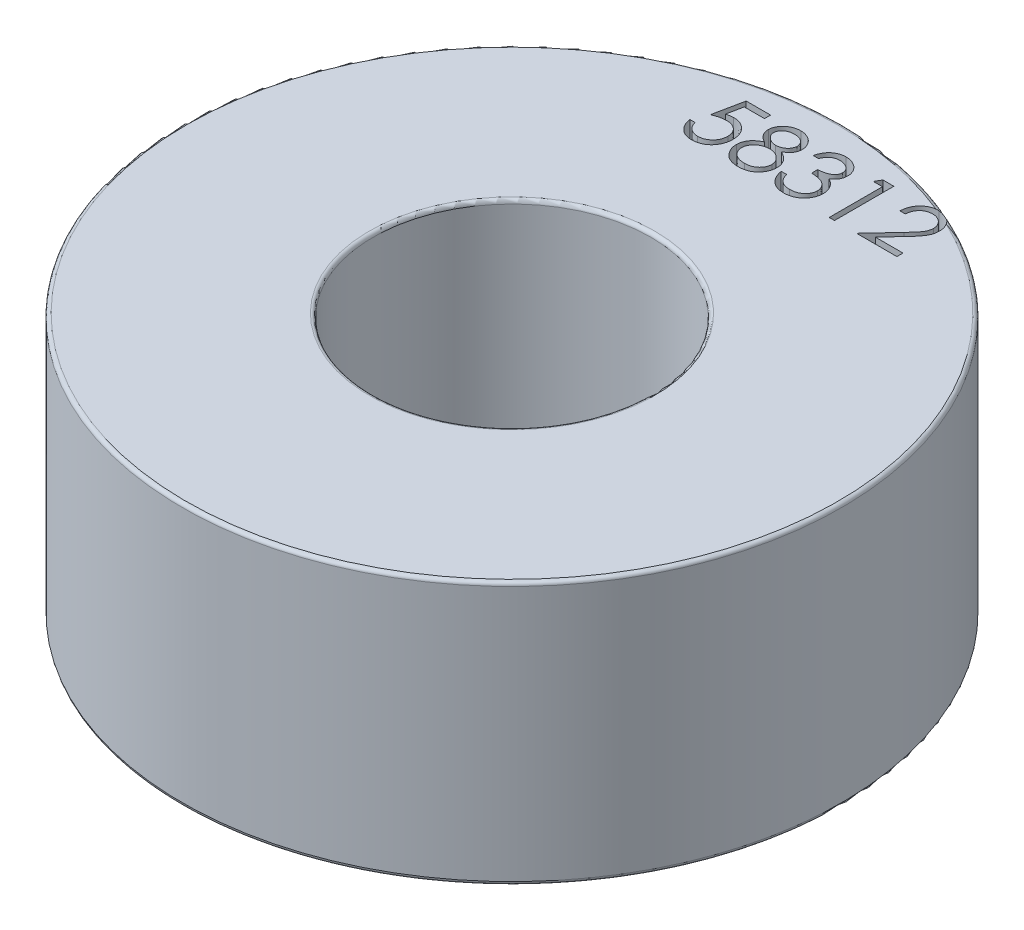
from build123d import *

# Parameters (mm, degrees)
CUT_EXTRUDE1_DEPTH = 1


with BuildPart() as part:
    # Toroidal Core TC229 → Revolve2 (revolve)
    with BuildSketch(Plane.XY, mode=Mode.PRIVATE) as revolve2_sk:
        with BuildLine():
            Line((5.719098459, 0), (13.073018459, 0))
            ThreePointArc((13.073018459, 0), (13.176297385, 0.042779532), (13.219076917, 0.146058459))
            Line((13.219076917, 0.146058459), (13.219076917, 10.397861541))
            ThreePointArc((13.219076917, 10.397861541), (13.176297385, 10.501140468), (13.073018459, 10.54392))
            Line((13.073018459, 10.54392), (5.719098459, 10.54392))
            ThreePointArc((5.719098459, 10.54392), (5.615819532, 10.501140468), (5.57304, 10.397861541))
            Line((5.57304, 10.397861541), (5.57304, 0.146058459))
            ThreePointArc((5.57304, 0.146058459), (5.615819532, 0.042779532), (5.719098459, 0))
        make_face()
    revolve(revolve2_sk.sketch.rotate(Axis((0, -8.107972275, 0), (0, 1, 0)), 90), axis=Axis((0, -8.107972275, 0), (0, 1, 0)))

    # Sketch1 → Cut-Extrude1 (cut)
    # profile 1 of 5: a face of its own
    with BuildSketch(Plane(origin=(0, 10.54392, 0), x_dir=(1, 0, 0), z_dir=(0, 1, 0))):
        with BuildLine():
            Line((-1.697112471, 12.070301335), (-1.697112471, 11.826070566))
            Line((-1.697112471, 11.826070566), (-2.507080921, 11.826070566))
            Line((-2.507080921, 11.826070566), (-2.635397477, 11.199752206))
            add(Edge.make_bspline(
                [(-2.635397477, 11.199752206), (-2.610186248, 11.206712445), (-2.56134348, 11.220196806), (-2.489252932, 11.235168589), (-2.420814308, 11.244193829), (-2.376403743, 11.245426167), (-2.354913703, 11.246022489)],
                knots=[0, 0, 0, 0, 1.100273476, 2.13160584, 3.095893838, 4, 4, 4, 4], degree=3))
            add(Edge.make_bspline(
                [(-2.354913703, 11.246022489), (-2.328322802, 11.24544695), (-2.276038446, 11.244315298), (-2.199539805, 11.233448736), (-2.126515104, 11.216344616), (-2.057117063, 11.192450118), (-1.991217296, 11.16189546), (-1.929422116, 11.123727465), (-1.870803964, 11.079141395), (-1.816414449, 11.027879878), (-1.767072018, 10.971463564), (-1.723688372, 10.910804369), (-1.686838466, 10.846491799), (-1.657201596, 10.777911385), (-1.633535825, 10.705821318), (-1.6177842, 10.629463079), (-1.607295332, 10.549556412), (-1.606123494, 10.494920624), (-1.605525933, 10.467059899)],
                knots=[0, 0, 0, 0, 1.052922333, 2.070308379, 3.05430497, 4.020497103, 4.973039431, 5.925935799, 6.892292201, 7.88610001, 8.88166317, 9.857072816, 10.836096531, 11.812156883, 12.81219415, 13.836441305, 14.89672472, 16, 16, 16, 16], degree=3))
            add(Edge.make_bspline(
                [(-1.605525933, 10.467059899), (-1.605978421, 10.447654602), (-1.606877284, 10.409106255), (-1.611448323, 10.351858147), (-1.62024923, 10.295822006), (-1.632065485, 10.240990396), (-1.64740238, 10.187467127), (-1.665968683, 10.135098998), (-1.688689909, 10.084211953), (-1.713612326, 10.034324497), (-1.741674662, 9.986564441), (-1.772820397, 9.941899684), (-1.805726204, 9.8996602), (-1.841132933, 9.860298999), (-1.879369681, 9.824074732), (-1.919973373, 9.790772419), (-1.962620008, 9.759828871), (-2.007969379, 9.732500152), (-2.055010961, 9.707352141), (-2.104424087, 9.686721306), (-2.155083957, 9.668276464), (-2.207719702, 9.653574268), (-2.2622121, 9.642054084), (-2.318650974, 9.634229568), (-2.376740323, 9.628530599), (-2.416116001, 9.628173849), (-2.436005951, 9.627993643)],
                knots=[0, 0, 0, 0, 1.056347294, 2.098418968, 3.122841568, 4.141288669, 5.149314143, 6.15115421, 7.162517403, 8.180376062, 9.185164535, 10.17417709, 11.141909838, 12.097768115, 13.052685741, 14.0056014, 14.954263652, 15.917497458, 16.885230207, 17.854509472, 18.828990115, 19.81800267, 20.826176721, 21.857883937, 22.917946725, 24, 24, 24, 24], degree=3))
            add(Edge.make_bspline(
                [(-2.436005951, 9.627993643), (-2.459732849, 9.628463659), (-2.506412717, 9.629388361), (-2.574802603, 9.639062009), (-2.640603076, 9.652916745), (-2.703284448, 9.67376035), (-2.763408469, 9.69987742), (-2.820165711, 9.732885744), (-2.875006426, 9.77029117), (-2.925701223, 9.814432982), (-2.972752079, 9.862680972), (-3.014870614, 9.915039653), (-3.052381137, 9.970644863), (-3.084682961, 10.029766643), (-3.112236079, 10.092249643), (-3.133881634, 10.158327971), (-3.151352086, 10.227656366), (-3.158743092, 10.275385808), (-3.162497087, 10.299628258)],
                knots=[0, 0, 0, 0, 1.0467383, 2.05933395, 3.04377827, 4.011590433, 4.970194871, 5.932262533, 6.905835911, 7.896367577, 8.894135286, 9.877477877, 10.858688626, 11.851381753, 12.8477658, 13.868841284, 14.917554742, 16, 16, 16, 16], degree=3))
            Line((-3.162497087, 10.299628258), (-2.948795164, 10.299628258))
            add(Edge.make_bspline(
                [(-2.948795164, 10.299628258), (-2.943536984, 10.27692035), (-2.933430472, 10.23327449), (-2.911246918, 10.171952989), (-2.884123885, 10.117307231), (-2.851871998, 10.068614354), (-2.81339778, 10.026153947), (-2.769494723, 9.988314481), (-2.720272432, 9.954177474), (-2.665576324, 9.925723055), (-2.60787314, 9.901455564), (-2.547479735, 9.885295929), (-2.486040527, 9.873933357), (-2.444485422, 9.872795963), (-2.423603607, 9.872224412)],
                knots=[0, 0, 0, 0, 1.136247022, 2.183929868, 3.172523383, 4.106158343, 5.02341133, 5.958108904, 6.928429099, 7.938127109, 8.96079061, 9.975095812, 10.982467395, 12, 12, 12, 12], degree=3))
            add(Edge.make_bspline(
                [(-2.423603607, 9.872224412), (-2.403221165, 9.872782834), (-2.363087971, 9.873882372), (-2.304025224, 9.882345342), (-2.247002536, 9.895379333), (-2.192582567, 9.914885073), (-2.139813019, 9.938591927), (-2.090028722, 9.969014148), (-2.041789443, 10.004025339), (-1.996594588, 10.044136903), (-1.955202034, 10.088339499), (-1.918628673, 10.13560894), (-1.88816438, 10.186034866), (-1.86249171, 10.238744279), (-1.842997233, 10.294314869), (-1.829090066, 10.352486204), (-1.820923699, 10.413401967), (-1.819800307, 10.454950908), (-1.819227856, 10.47612315)],
                knots=[0, 0, 0, 0, 1.027316725, 2.022795036, 3.002884548, 3.971462791, 4.93288096, 5.914575861, 6.907176829, 7.935150275, 8.956128384, 9.956726525, 10.942570165, 11.921478529, 12.907843606, 13.90538589, 14.932640048, 16, 16, 16, 16], degree=3))
            add(Edge.make_bspline(
                [(-1.819227856, 10.47612315), (-1.819675857, 10.495224688), (-1.820552756, 10.532613231), (-1.827717304, 10.587313405), (-1.840179387, 10.639070243), (-1.857476706, 10.688133677), (-1.879438299, 10.734549984), (-1.90627588, 10.778367066), (-1.938493102, 10.819007406), (-1.975294905, 10.856490018), (-2.015611536, 10.891082692), (-2.060136654, 10.920572151), (-2.107938497, 10.945380638), (-2.158441135, 10.966790115), (-2.212845825, 10.982166694), (-2.270075177, 10.993710916), (-2.330747187, 11.000388868), (-2.37222903, 11.001315438), (-2.393551774, 11.001791719)],
                knots=[0, 0, 0, 0, 1.045622112, 2.046656509, 3.013763289, 3.955457236, 4.890082067, 5.820317437, 6.762574623, 7.722996705, 8.69280354, 9.665887285, 10.63943826, 11.638615906, 12.663482002, 13.728887084, 14.832589034, 16, 16, 16, 16], degree=3))
            add(Edge.make_bspline(
                [(-2.393551774, 11.001791719), (-2.412009135, 11.00139671), (-2.450118901, 11.000581116), (-2.50857711, 10.994575946), (-2.570007729, 10.98488814), (-2.63417527, 10.971562497), (-2.701272437, 10.954124211), (-2.771157634, 10.933227381), (-2.843977801, 10.908243307), (-2.89304361, 10.889375497), (-2.918266317, 10.879676335)],
                knots=[0, 0, 0, 0, 0.817624296, 1.688186739, 2.600797293, 3.572016777, 4.590301741, 5.671205678, 6.80286297, 8, 8, 8, 8], degree=3))
            Line((-2.918266317, 10.879676335), (-2.674035548, 12.070301335))
            Line((-2.674035548, 12.070301335), (-1.697112471, 12.070301335))
        make_face()
    # profile 2 of 5: a face of its own
    with BuildSketch(Plane(origin=(0, 10.54392, 0), x_dir=(1, 0, 0), z_dir=(0, 1, 0))):
        with BuildLine():
            add(Edge.make_bspline(
                [(-0.203584076, 11.015625103), (-0.184092832, 11.005461958), (-0.146078397, 10.985640431), (-0.091937475, 10.953724314), (-0.042458501, 10.920086801), (0.003731327, 10.886316689), (0.0458205, 10.851120691), (0.083338395, 10.814358847), (0.117211758, 10.776948766), (0.146757481, 10.738256964), (0.172744971, 10.698386233), (0.195205013, 10.657231924), (0.214402789, 10.614884228), (0.229617574, 10.570880884), (0.242150971, 10.525868278), (0.25077491, 10.479265187), (0.255412849, 10.431378697), (0.256289702, 10.399015264), (0.256733683, 10.382628558)],
                knots=[0, 0, 0, 0, 1.272397273, 2.481599622, 3.635517121, 4.734568067, 5.792894095, 6.808321871, 7.773003508, 8.711915296, 9.623354172, 10.525449501, 11.423591555, 12.311487226, 13.218079475, 14.126165749, 15.051214107, 16, 16, 16, 16], degree=3))
            add(Edge.make_bspline(
                [(0.256733683, 10.382628558), (0.256208841, 10.359702065), (0.255169983, 10.314321933), (0.246121244, 10.247343418), (0.232573307, 10.182293259), (0.212788853, 10.119185718), (0.187130278, 10.058369019), (0.155509431, 9.999791104), (0.119715021, 9.942491895), (0.090968409, 9.907236195), (0.076422685, 9.889396888)],
                knots=[0, 0, 0, 0, 1.025265484, 2.029385089, 3.018602448, 3.995076438, 4.983346944, 5.966715145, 6.97116228, 8, 8, 8, 8], degree=3))
            add(Edge.make_bspline(
                [(0.076422685, 9.889396888), (0.057483941, 9.868582195), (0.019840484, 9.827210022), (-0.044645758, 9.773495275), (-0.11541779, 9.728353991), (-0.192201762, 9.691565791), (-0.274792426, 9.662932376), (-0.363172183, 9.642356663), (-0.457513329, 9.630571225), (-0.522355088, 9.628867617), (-0.555619833, 9.627993643)],
                knots=[0, 0, 0, 0, 0.954267603, 1.896743057, 2.838368354, 3.796610408, 4.779680527, 5.799409237, 6.871065594, 8, 8, 8, 8], degree=3))
            add(Edge.make_bspline(
                [(-0.555619833, 9.627993643), (-0.587605728, 9.628777739), (-0.64984703, 9.630303512), (-0.740441943, 9.640641152), (-0.82488996, 9.658757611), (-0.903682099, 9.683552961), (-0.976343353, 9.715808849), (-1.042666678, 9.755955641), (-1.103608969, 9.80237739), (-1.157320767, 9.856407325), (-1.20500594, 9.914277056), (-1.246894205, 9.973979491), (-1.281710855, 10.035520079), (-1.311188753, 10.097981196), (-1.333754854, 10.162238312), (-1.349384162, 10.227960821), (-1.359310106, 10.295033927), (-1.360630771, 10.340299213), (-1.361295164, 10.363071016)],
                knots=[0, 0, 0, 0, 1.256902934, 2.445805442, 3.576955095, 4.645999104, 5.686449165, 6.692658513, 7.68621702, 8.689161843, 9.678783111, 10.630372946, 11.551080876, 12.453998257, 13.34127905, 14.221779781, 15.105423033, 16, 16, 16, 16], degree=3))
            add(Edge.make_bspline(
                [(-1.361295164, 10.363071016), (-1.360901998, 10.379780038), (-1.360124964, 10.412802963), (-1.354746844, 10.461590916), (-1.346100552, 10.509077215), (-1.334357957, 10.555437257), (-1.318443705, 10.60033353), (-1.299228968, 10.643978763), (-1.276823479, 10.68642223), (-1.250914686, 10.72789604), (-1.220773488, 10.767819066), (-1.186644291, 10.80686884), (-1.147844973, 10.844439432), (-1.104807173, 10.880989868), (-1.058022727, 10.917168521), (-1.006276443, 10.951020187), (-0.950940093, 10.984941409), (-0.911611772, 11.005221716), (-0.891437141, 11.015625103)],
                knots=[0, 0, 0, 0, 0.941657376, 1.861047343, 2.762797495, 3.66048619, 4.553285746, 5.444104102, 6.34607688, 7.256116206, 8.197091036, 9.162375105, 10.176350973, 11.237807142, 12.343728897, 13.50695164, 14.721116704, 16, 16, 16, 16], degree=3))
            add(Edge.make_bspline(
                [(-0.891437141, 11.015625103), (-0.919053772, 11.030684651), (-0.972527301, 11.059844151), (-1.043331689, 11.113420103), (-1.104149238, 11.171446277), (-1.153308251, 11.235147977), (-1.192001678, 11.302535225), (-1.218548264, 11.373186404), (-1.236507301, 11.445791474), (-1.238286317, 11.495393725), (-1.239179779, 11.520305091)],
                knots=[0, 0, 0, 0, 1.166880483, 2.259407225, 3.286803203, 4.280235371, 5.237608625, 6.161067461, 7.076446754, 8, 8, 8, 8], degree=3))
            add(Edge.make_bspline(
                [(-1.239179779, 11.520305091), (-1.238067106, 11.545680751), (-1.235830441, 11.596690254), (-1.217744289, 11.672622277), (-1.188271172, 11.74720069), (-1.148183851, 11.820064023), (-1.098254334, 11.888746223), (-1.038351238, 11.950346402), (-0.969905066, 12.004306536), (-0.893257482, 12.04960211), (-0.810773543, 12.08646635), (-0.723745166, 12.111897027), (-0.633688677, 12.128522313), (-0.57239005, 12.130404627), (-0.541309436, 12.131359027)],
                knots=[0, 0, 0, 0, 0.888701115, 1.786444228, 2.72001202, 3.692817113, 4.693886446, 5.687152267, 6.695133018, 7.739871481, 8.800368666, 9.853104506, 10.91144658, 12, 12, 12, 12], degree=3))
            add(Edge.make_bspline(
                [(-0.541309436, 12.131359027), (-0.511030948, 12.130374997), (-0.451325218, 12.128434603), (-0.363562802, 12.11225103), (-0.279589805, 12.085220768), (-0.199695807, 12.048551407), (-0.12531109, 12.003384577), (-0.059587019, 11.948683268), (-0.001530387, 11.88735482), (0.04649221, 11.818693448), (0.086063747, 11.746110094), (0.113618825, 11.670166915), (0.131275435, 11.592504787), (0.133502492, 11.53995536), (0.134618298, 11.513626906)],
                knots=[0, 0, 0, 0, 1.072916533, 2.115669174, 3.151510826, 4.193348718, 5.225979165, 6.227137561, 7.216255879, 8.211077061, 9.189680878, 10.138522389, 11.067357538, 12, 12, 12, 12], degree=3))
            add(Edge.make_bspline(
                [(0.134618298, 11.513626906), (0.133642284, 11.487789211), (0.131725449, 11.437045448), (0.115601026, 11.363072583), (0.088445718, 11.293797231), (0.051370225, 11.228433312), (0.003047527, 11.168166258), (-0.055877343, 11.112229695), (-0.124934599, 11.060164121), (-0.176819237, 11.030781969), (-0.203584076, 11.015625103)],
                knots=[0, 0, 0, 0, 0.975232327, 1.915300861, 2.843280834, 3.77672583, 4.742871857, 5.749627742, 6.839139064, 8, 8, 8, 8], degree=3))
        make_face()
        with BuildLine():
            add(Edge.make_bspline(
                [(-0.553234767, 11.887128258), (-0.569938083, 11.886685046), (-0.602617073, 11.885817929), (-0.650533722, 11.881287678), (-0.696098851, 11.872474864), (-0.73978853, 11.860746383), (-0.781003757, 11.844902234), (-0.820304284, 11.826263844), (-0.857021247, 11.803603825), (-0.891597884, 11.778184867), (-0.92272475, 11.750227015), (-0.950350347, 11.721098395), (-0.97329751, 11.690226923), (-0.992783694, 11.658380521), (-1.006922548, 11.624614004), (-1.017511833, 11.589962614), (-1.024670137, 11.553988469), (-1.025206524, 11.529402736), (-1.025477856, 11.516965998)],
                knots=[0, 0, 0, 0, 1.203892937, 2.355340988, 3.463153438, 4.544400666, 5.610487187, 6.640501085, 7.674077295, 8.714426146, 9.728707835, 10.68524104, 11.601827946, 12.495867327, 13.368432065, 14.231010473, 15.105153427, 16, 16, 16, 16], degree=3))
            add(Edge.make_bspline(
                [(-1.025477856, 11.516965998), (-1.025010201, 11.504528723), (-1.024086047, 11.479950881), (-1.016938809, 11.44365664), (-1.006286556, 11.407991205), (-0.989515302, 11.373802638), (-0.969399619, 11.33990496), (-0.944572382, 11.307145365), (-0.914984312, 11.275409844), (-0.881628143, 11.244968324), (-0.845289221, 11.216462202), (-0.806791863, 11.191715448), (-0.766619229, 11.171009383), (-0.725184071, 11.153776342), (-0.682064092, 11.140380152), (-0.637523509, 11.130876484), (-0.591554837, 11.124969625), (-0.560407692, 11.124264081), (-0.544648529, 11.123907104)],
                knots=[0, 0, 0, 0, 0.873023192, 1.725219244, 2.590779336, 3.480155217, 4.391973325, 5.357036234, 6.360879153, 7.436073238, 8.526419356, 9.601555421, 10.645666583, 11.697338044, 12.750135903, 13.812665442, 14.89329948, 16, 16, 16, 16], degree=3))
            add(Edge.make_bspline(
                [(-0.544648529, 11.123907104), (-0.524407833, 11.124500966), (-0.484126358, 11.125682823), (-0.424745241, 11.136671389), (-0.367008335, 11.153956487), (-0.311532759, 11.177605678), (-0.259754461, 11.207288204), (-0.213598986, 11.242825311), (-0.173460029, 11.283396434), (-0.139754721, 11.328369971), (-0.113622307, 11.376234176), (-0.093278399, 11.42426759), (-0.081398536, 11.472982679), (-0.079848977, 11.505617346), (-0.079083625, 11.521736131)],
                knots=[0, 0, 0, 0, 1.076279235, 2.141928126, 3.20205304, 4.278698113, 5.344010996, 6.36967002, 7.368914609, 8.37248503, 9.349703398, 10.264243087, 11.142681841, 12, 12, 12, 12], degree=3))
            add(Edge.make_bspline(
                [(-0.079083625, 11.521736131), (-0.079445505, 11.533049134), (-0.080163786, 11.555503823), (-0.086082931, 11.588663318), (-0.095863632, 11.621068445), (-0.109105477, 11.652986905), (-0.126529284, 11.683970867), (-0.147187776, 11.714507396), (-0.17228241, 11.74390955), (-0.200446769, 11.772862521), (-0.232386413, 11.799657723), (-0.268039789, 11.823221696), (-0.307224109, 11.843232603), (-0.349940298, 11.859485488), (-0.396031041, 11.871692693), (-0.44528405, 11.880834208), (-0.498110004, 11.885986629), (-0.534461317, 11.886739461), (-0.553234767, 11.887128258)],
                knots=[0, 0, 0, 0, 0.814439003, 1.616544685, 2.417341072, 3.248991801, 4.09997495, 4.973547432, 5.9003056, 6.880240646, 7.880314356, 8.896779544, 9.951930927, 11.043077905, 12.18215768, 13.381699519, 14.647792085, 16, 16, 16, 16], degree=3))
        make_face(mode=Mode.SUBTRACT)
        with BuildLine():
            add(Edge.make_bspline(
                [(-0.539401383, 10.879676335), (-0.560578034, 10.879299661), (-0.602121455, 10.878560719), (-0.662984115, 10.870335541), (-0.72139493, 10.858885543), (-0.777156958, 10.841515455), (-0.830246652, 10.818929985), (-0.880951413, 10.791760236), (-0.928883342, 10.759643676), (-0.973380554, 10.722988335), (-1.014013748, 10.683487171), (-1.049663306, 10.641670968), (-1.079937512, 10.598316888), (-1.10431692, 10.552874318), (-1.124327402, 10.506305497), (-1.137467736, 10.457450687), (-1.145891722, 10.407249097), (-1.147022905, 10.373122316), (-1.14759324, 10.355915818)],
                knots=[0, 0, 0, 0, 1.140299081, 2.23698856, 3.303958914, 4.344563908, 5.37730929, 6.408454204, 7.439741482, 8.480804886, 9.510774543, 10.48932336, 11.43758569, 12.353841022, 13.263987381, 14.161954604, 15.073269652, 16, 16, 16, 16], degree=3))
            add(Edge.make_bspline(
                [(-1.14759324, 10.355915818), (-1.146665738, 10.334531577), (-1.144825594, 10.292105741), (-1.130227416, 10.229401937), (-1.106798954, 10.168699755), (-1.074124655, 10.110493873), (-1.033665467, 10.056099247), (-0.983913352, 10.008685991), (-0.927960211, 9.966557271), (-0.86391285, 9.932484622), (-0.793952768, 9.905273837), (-0.718098574, 9.886525941), (-0.637438888, 9.87411524), (-0.58174513, 9.87286462), (-0.553234767, 9.872224412)],
                knots=[0, 0, 0, 0, 0.898778495, 1.783155532, 2.693654817, 3.627872908, 4.583023416, 5.533784346, 6.509005473, 7.520592997, 8.575161974, 9.658835044, 10.801527049, 12, 12, 12, 12], degree=3))
            add(Edge.make_bspline(
                [(-0.553234767, 9.872224412), (-0.53095282, 9.872652226), (-0.487540443, 9.873485746), (-0.424208752, 9.880843328), (-0.364443086, 9.892511198), (-0.308359343, 9.909481717), (-0.255329695, 9.930198576), (-0.206253252, 9.956849582), (-0.159867504, 9.987161073), (-0.118458164, 10.023123497), (-0.080743784, 10.061549725), (-0.047859883, 10.102228308), (-0.019313764, 10.144053693), (0.003091047, 10.187971077), (0.021002302, 10.233137888), (0.033877078, 10.27997062), (0.041821074, 10.328612912), (0.042624505, 10.361609602), (0.04303176, 10.378335439)],
                knots=[0, 0, 0, 0, 1.224942928, 2.386581632, 3.501229538, 4.569074225, 5.605009692, 6.626002462, 7.634866581, 8.645888296, 9.63523824, 10.59253846, 11.518950513, 12.414518923, 13.29783783, 14.186679152, 15.080837789, 16, 16, 16, 16], degree=3))
            add(Edge.make_bspline(
                [(0.04303176, 10.378335439), (0.042415459, 10.394580559), (0.041200222, 10.426613096), (0.033487223, 10.474079251), (0.019937314, 10.519937237), (0.001344924, 10.564738759), (-0.023407124, 10.607576052), (-0.052556937, 10.64956509), (-0.0877274, 10.689540457), (-0.127468827, 10.727812652), (-0.170779655, 10.76320193), (-0.216817481, 10.794508182), (-0.265227927, 10.820873462), (-0.315908555, 10.842315934), (-0.368746829, 10.859180266), (-0.423703888, 10.870961327), (-0.480844073, 10.87837695), (-0.519661762, 10.879238313), (-0.539401383, 10.879676335)],
                knots=[0, 0, 0, 0, 0.917430815, 1.809013306, 2.70690318, 3.612392954, 4.541220862, 5.495268465, 6.494511384, 7.542276156, 8.608045339, 9.649016899, 10.681629292, 11.715607085, 12.752076957, 13.808767841, 14.885711793, 16, 16, 16, 16], degree=3))
        make_face(mode=Mode.SUBTRACT)
    # profile 3 of 5: a face of its own
    with BuildSketch(Plane(origin=(0, 10.54392, 0), x_dir=(1, 0, 0), z_dir=(0, 1, 0))):
        with BuildLine():
            Line((0.775724067, 11.520782104), (0.562022144, 11.520782104))
            add(Edge.make_bspline(
                [(0.562022144, 11.520782104), (0.567811678, 11.544752776), (0.579129742, 11.59161348), (0.602736484, 11.658565562), (0.628453478, 11.721922815), (0.659334279, 11.780498894), (0.693017914, 11.835471005), (0.731609622, 11.88559232), (0.773328934, 11.932137569), (0.819474122, 11.973444254), (0.867867015, 12.010848745), (0.919189498, 12.042740525), (0.972409002, 12.070175351), (1.027894259, 12.092776973), (1.085810458, 12.109803266), (1.145634005, 12.122156379), (1.207521672, 12.130178548), (1.249532086, 12.130961477), (1.270863791, 12.131359027)],
                knots=[0, 0, 0, 0, 1.162005537, 2.271625781, 3.343758855, 4.383309926, 5.390229558, 6.379919256, 7.361854164, 8.333198761, 9.295911338, 10.242430842, 11.177959212, 12.116337295, 13.062827104, 14.020064771, 14.994644689, 16, 16, 16, 16], degree=3))
            add(Edge.make_bspline(
                [(1.270863791, 12.131359027), (1.301944371, 12.130420658), (1.363427573, 12.128564388), (1.45375386, 12.111613673), (1.540857821, 12.084790503), (1.623786041, 12.047728914), (1.700815011, 12.002017545), (1.769351595, 11.947612965), (1.828466814, 11.885564869), (1.878061024, 11.81703075), (1.916892408, 11.743786555), (1.945526172, 11.668402876), (1.962958066, 11.591058535), (1.965217231, 11.538836172), (1.966349067, 11.512672879)],
                knots=[0, 0, 0, 0, 1.083050992, 2.142477498, 3.193116406, 4.255571735, 5.30263384, 6.308962982, 7.297363603, 8.282367274, 9.249857812, 10.179914175, 11.08814088, 12, 12, 12, 12], degree=3))
            add(Edge.make_bspline(
                [(1.966349067, 11.512672879), (1.96555741, 11.487495042), (1.964008259, 11.438225922), (1.950854434, 11.366297546), (1.928718155, 11.298505672), (1.898054621, 11.234564917), (1.85836153, 11.174880696), (1.810278856, 11.119318723), (1.753467224, 11.067632564), (1.710414946, 11.03802378), (1.688250359, 11.022780301)],
                knots=[0, 0, 0, 0, 1.024540389, 2.004866551, 2.965041327, 3.920577974, 4.882998113, 5.874504559, 6.905732034, 8, 8, 8, 8], degree=3))
            add(Edge.make_bspline(
                [(1.688250359, 11.022780301), (1.713581249, 11.010548724), (1.763769069, 10.986314431), (1.83217934, 10.938787568), (1.894280895, 10.883912446), (1.928913604, 10.841088962), (1.946314512, 10.819572669)],
                knots=[0, 0, 0, 0, 1.015518401, 2.012035669, 3.001164323, 4, 4, 4, 4], degree=3))
            add(Edge.make_bspline(
                [(1.946314512, 10.819572669), (1.95777264, 10.803885163), (1.98050126, 10.772767045), (2.00855615, 10.722736012), (2.034007708, 10.672150445), (2.053840268, 10.619654492), (2.069198559, 10.565856603), (2.080176824, 10.510664401), (2.08699682, 10.454032818), (2.087973508, 10.41572022), (2.088464452, 10.396461942)],
                knots=[0, 0, 0, 0, 1.025084078, 2.033381695, 3.024893161, 4.013698104, 4.991890475, 5.976764909, 6.982997093, 8, 8, 8, 8], degree=3))
            add(Edge.make_bspline(
                [(2.088464452, 10.396461942), (2.087243542, 10.363117828), (2.084807467, 10.296586518), (2.063033267, 10.198292109), (2.029278544, 10.10220833), (1.981342664, 10.010309198), (1.922922091, 9.924325403), (1.853418626, 9.847393129), (1.77362198, 9.781263364), (1.684627423, 9.726011405), (1.588209162, 9.681844033), (1.485083626, 9.65118888), (1.376736714, 9.63122312), (1.302436749, 9.629082125), (1.264662619, 9.627993643)],
                knots=[0, 0, 0, 0, 0.955779014, 1.907060117, 2.875433937, 3.871313158, 4.872415639, 5.851225146, 6.836215519, 7.83643374, 8.849228613, 9.86973379, 10.916971861, 12, 12, 12, 12], degree=3))
            add(Edge.make_bspline(
                [(1.264662619, 9.627993643), (1.239204131, 9.628584338), (1.189110315, 9.629746629), (1.115466078, 9.637692248), (1.045170422, 9.65220427), (0.978128303, 9.671732769), (0.914280162, 9.69649215), (0.853820833, 9.72732505), (0.796378352, 9.763595911), (0.74249478, 9.80573287), (0.69217654, 9.852868925), (0.646760847, 9.905840858), (0.605490524, 9.963669449), (0.569470621, 10.027026386), (0.53706048, 10.095092891), (0.510403437, 10.16874053), (0.486940934, 10.247310909), (0.476032452, 10.302064515), (0.470435606, 10.330157104)],
                knots=[0, 0, 0, 0, 1.048658725, 2.063410685, 3.046034179, 4.001477787, 4.936774919, 5.862367409, 6.792675028, 7.730719943, 8.675894397, 9.627829632, 10.600096036, 11.597688215, 12.626045268, 13.701542398, 14.82072376, 16, 16, 16, 16], degree=3))
            Line((0.470435606, 10.330157104), (0.684137529, 10.330157104))
            add(Edge.make_bspline(
                [(0.684137529, 10.330157104), (0.68970509, 10.31182215), (0.700534479, 10.276159073), (0.718968278, 10.224832722), (0.739969727, 10.177780547), (0.762499454, 10.134657387), (0.786161218, 10.095038556), (0.812637265, 10.059971677), (0.83996663, 10.027916513), (0.860567405, 10.009856696), (0.870649698, 10.001017982)],
                knots=[0, 0, 0, 0, 1.198163088, 2.33053128, 3.407730985, 4.417276592, 5.372219308, 6.28897303, 7.162600585, 8, 8, 8, 8], degree=3))
            add(Edge.make_bspline(
                [(0.870649698, 10.001017982), (0.883982369, 9.990738919), (0.910606556, 9.970212522), (0.953991727, 9.944017664), (0.999619802, 9.921320252), (1.048479428, 9.903982238), (1.099516263, 9.889301722), (1.153555238, 9.879694726), (1.210119599, 9.873103309), (1.248741952, 9.872521651), (1.268478725, 9.872224412)],
                knots=[0, 0, 0, 0, 0.946170439, 1.889420265, 2.845303464, 3.807233317, 4.801018734, 5.828864929, 6.890507805, 8, 8, 8, 8], degree=3))
            add(Edge.make_bspline(
                [(1.268478725, 9.872224412), (1.290762804, 9.872643447), (1.334337398, 9.873462835), (1.397920079, 9.880998271), (1.458408896, 9.891972713), (1.515132262, 9.908922439), (1.568833196, 9.929864411), (1.618758925, 9.95615913), (1.665564848, 9.987009735), (1.708651461, 10.02207477), (1.747394744, 10.060461537), (1.78150752, 10.100611502), (1.810507513, 10.142355379), (1.833900626, 10.185924172), (1.852372697, 10.231137461), (1.864947874, 10.278122129), (1.873691494, 10.326493662), (1.874403564, 10.359374621), (1.874762529, 10.375950373)],
                knots=[0, 0, 0, 0, 1.217147791, 2.380027433, 3.494444702, 4.572153297, 5.609568379, 6.639424714, 7.649109417, 8.668170816, 9.669597737, 10.625200337, 11.543417969, 12.441394052, 13.322311151, 14.205496177, 15.095365482, 16, 16, 16, 16], degree=3))
            add(Edge.make_bspline(
                [(1.874762529, 10.375950373), (1.873721377, 10.398137731), (1.871644255, 10.442402044), (1.855786096, 10.50752418), (1.829701976, 10.570269037), (1.7931855, 10.629566101), (1.74873387, 10.684522563), (1.69677846, 10.733556911), (1.636887826, 10.774017812), (1.58176538, 10.801972773), (1.532939443, 10.821047997), (1.491155047, 10.833753643), (1.444376001, 10.844512576), (1.393168003, 10.854522175), (1.337145207, 10.863041164), (1.276368606, 10.870145328), (1.210825882, 10.87582974), (1.165452071, 10.878368217), (1.142070221, 10.879676335)],
                knots=[0, 0, 0, 0, 1.07054697, 2.135767047, 3.216561865, 4.33974944, 5.486079747, 6.621378074, 7.775625952, 8.963672916, 9.598146892, 10.304877434, 11.070270905, 11.915000392, 12.823868403, 13.805723172, 14.86925407, 16, 16, 16, 16], degree=3))
            Line((1.142070221, 10.879676335), (1.142070221, 11.123907104))
            add(Edge.make_bspline(
                [(1.142070221, 11.123907104), (1.171530478, 11.124407033), (1.229235886, 11.125386271), (1.313528261, 11.137229935), (1.394132425, 11.153613363), (1.469262048, 11.178708467), (1.537739119, 11.207855169), (1.597147634, 11.241772475), (1.646655282, 11.279474296), (1.686021475, 11.321542553), (1.715636897, 11.36666047), (1.737290486, 11.413684481), (1.750081422, 11.463026744), (1.751788892, 11.496700795), (1.752647144, 11.513626906)],
                knots=[0, 0, 0, 0, 1.321986639, 2.589447074, 3.816329219, 5.01088745, 6.139805852, 7.153945165, 8.075214402, 8.924034688, 9.728124013, 10.488707548, 11.240355623, 12, 12, 12, 12], degree=3))
            add(Edge.make_bspline(
                [(1.752647144, 11.513626906), (1.752365197, 11.5260623), (1.751804276, 11.550801928), (1.744730413, 11.586945948), (1.734100486, 11.621984984), (1.719486598, 11.65577003), (1.699926195, 11.68806677), (1.676517837, 11.719150552), (1.648644897, 11.748843909), (1.616705227, 11.776521055), (1.582407195, 11.802897982), (1.544817616, 11.82529101), (1.505069876, 11.844439704), (1.46311997, 11.860230455), (1.418831761, 11.872109006), (1.372413335, 11.880637856), (1.323776179, 11.88597026), (1.290593983, 11.886737986), (1.27372587, 11.887128258)],
                knots=[0, 0, 0, 0, 0.884392785, 1.759457502, 2.611959086, 3.489218968, 4.37281399, 5.2945488, 6.255912374, 7.266815255, 8.301784654, 9.332968512, 10.37626691, 11.440494194, 12.520033166, 13.637162961, 14.798855837, 16, 16, 16, 16], degree=3))
            add(Edge.make_bspline(
                [(1.27372587, 11.887128258), (1.246612503, 11.886181635), (1.193653791, 11.88433266), (1.117307571, 11.86813811), (1.046333167, 11.842299449), (0.992082396, 11.811456806), (0.952021216, 11.781010528), (0.92339387, 11.754420548), (0.895281166, 11.724870716), (0.869532589, 11.690541), (0.843492616, 11.653756273), (0.81978587, 11.61264659), (0.796749186, 11.568284314), (0.782868166, 11.53692282), (0.775724067, 11.520782104)],
                knots=[0, 0, 0, 0, 1.472543308, 2.876219568, 4.221790263, 5.565193594, 6.249813518, 6.953379497, 7.687249741, 8.463570142, 9.283606569, 10.136032583, 11.040678096, 12, 12, 12, 12], degree=3))
        make_face()
    # profile 4 of 5: a face of its own
    with BuildSketch(Plane(origin=(0, 10.54392, 0), x_dir=(1, 0, 0), z_dir=(0, 1, 0))):
        Polygon((2.808277403, 12.070301335), (3.248560606, 12.070301335), (3.248560606, 9.689051335), (3.034858683, 9.689051335), (3.034858683, 11.826070566), (2.668512529, 11.826070566), align=None)
    # profile 5 of 5: a face of its own
    with BuildSketch(Plane(origin=(0, 10.54392, 0), x_dir=(1, 0, 0), z_dir=(0, 1, 0))):
        with BuildLine():
            Line((4.439185606, 11.337609027), (4.225483683, 11.337609027))
            add(Edge.make_bspline(
                [(4.225483683, 11.337609027), (4.226876478, 11.365960113), (4.22961189, 11.421640892), (4.242421852, 11.502823764), (4.26075127, 11.580421761), (4.286667063, 11.653811827), (4.318852227, 11.723642873), (4.357448906, 11.789637527), (4.403164722, 11.851544032), (4.455012518, 11.908788495), (4.511324753, 11.96130361), (4.572084687, 12.006652981), (4.635932821, 12.044969111), (4.702675448, 12.07700117), (4.773065581, 12.101044886), (4.846464454, 12.118884966), (4.923194545, 12.129618516), (4.975473203, 12.130772255), (5.002061207, 12.131359027)],
                knots=[0, 0, 0, 0, 1.10065271, 2.161652631, 3.183658789, 4.190468796, 5.17591951, 6.163126047, 7.15150782, 8.156236427, 9.156009102, 10.134482811, 11.092018607, 12.041330605, 13.001268258, 13.972401359, 14.968799086, 16, 16, 16, 16], degree=3))
            add(Edge.make_bspline(
                [(5.002061207, 12.131359027), (5.028172004, 12.130747756), (5.079478787, 12.12954663), (5.154360264, 12.119231715), (5.225646245, 12.103076232), (5.293197386, 12.080409851), (5.356474726, 12.049940446), (5.415953619, 12.013338906), (5.472342171, 11.971007199), (5.523101429, 11.921168444), (5.56971139, 11.867962893), (5.609922032, 11.811161302), (5.644357059, 11.752494591), (5.673059748, 11.691515404), (5.694189014, 11.627649579), (5.710230616, 11.561826929), (5.719298017, 11.49336612), (5.720689636, 11.447029338), (5.721397144, 11.423471407)],
                knots=[0, 0, 0, 0, 1.111607364, 2.184268762, 3.212621178, 4.221274766, 5.211760367, 6.196651075, 7.1921475, 8.207485113, 9.220403448, 10.201281604, 11.166441695, 12.114753415, 13.065576456, 14.026450734, 14.996634279, 16, 16, 16, 16], degree=3))
            add(Edge.make_bspline(
                [(5.721397144, 11.423471407), (5.720245121, 11.39030547), (5.71796129, 11.32455561), (5.698425259, 11.227934784), (5.667913615, 11.134322118), (5.631176127, 11.058981204), (5.594115411, 10.998270559), (5.560718375, 10.948285601), (5.52162178, 10.89446563), (5.476256588, 10.83699087), (5.425561223, 10.77541113), (5.369076501, 10.709763608), (5.306399632, 10.640726565), (5.262408759, 10.593574004), (5.239613791, 10.569140728)],
                knots=[0, 0, 0, 0, 1.184426356, 2.348067706, 3.509069118, 4.696110526, 5.333549288, 6.050745305, 6.844228056, 7.710549037, 8.667450064, 9.695053472, 10.805634456, 12, 12, 12, 12], degree=3))
            Line((5.239613791, 10.569140728), (4.643824278, 9.933282104))
            Line((4.643824278, 9.933282104), (5.75192599, 9.933282104))
            Line((5.75192599, 9.933282104), (5.75192599, 9.689051335))
            Line((5.75192599, 9.689051335), (4.133897144, 9.689051335))
            Line((4.133897144, 9.689051335), (5.05739474, 10.67456065))
            add(Edge.make_bspline(
                [(5.05739474, 10.67456065), (5.079879106, 10.698031819), (5.123066971, 10.743115132), (5.184151189, 10.808934896), (5.239014501, 10.869996637), (5.288012048, 10.926184985), (5.330080915, 10.978321819), (5.36741363, 11.024718573), (5.397325934, 11.067414012), (5.429789444, 11.116903608), (5.461231457, 11.177327702), (5.488250042, 11.251169373), (5.504724787, 11.327183807), (5.506701112, 11.378552158), (5.507695221, 11.404390878)],
                knots=[0, 0, 0, 0, 1.329631726, 2.553950428, 3.673215718, 4.687767853, 5.603093632, 6.413772471, 7.123043292, 7.734684054, 8.834405432, 9.900288307, 10.943827018, 12, 12, 12, 12], degree=3))
            add(Edge.make_bspline(
                [(5.507695221, 11.404390878), (5.507262689, 11.420638758), (5.506410252, 11.45266021), (5.498887069, 11.499608771), (5.487517956, 11.544896617), (5.471226629, 11.588663053), (5.449722758, 11.630468041), (5.423547119, 11.670362469), (5.393346022, 11.708931212), (5.358408819, 11.745094438), (5.320028839, 11.778215044), (5.279483465, 11.807554823), (5.236586877, 11.83207429), (5.191519936, 11.852174419), (5.144408287, 11.867941955), (5.095160808, 11.878867524), (5.043913576, 11.885727214), (5.00892043, 11.886655338), (4.991089903, 11.887128258)],
                knots=[0, 0, 0, 0, 0.991446411, 1.95395049, 2.89581595, 3.838931463, 4.798493298, 5.75982156, 6.748411868, 7.785213223, 8.824556874, 9.840280684, 10.836137867, 11.835679398, 12.848801643, 13.863922112, 14.911575587, 16, 16, 16, 16], degree=3))
            add(Edge.make_bspline(
                [(4.991089903, 11.887128258), (4.972467961, 11.886641781), (4.935897543, 11.88568642), (4.882204415, 11.8790035), (4.830983198, 11.867474276), (4.782105046, 11.85170586), (4.735487257, 11.831663526), (4.691356541, 11.806700036), (4.649811968, 11.776911623), (4.610775441, 11.743138316), (4.574809055, 11.705536609), (4.543208591, 11.663619831), (4.515596967, 11.618153321), (4.491506042, 11.569259761), (4.471941903, 11.516495493), (4.456992313, 11.460047822), (4.445163048, 11.400161847), (4.44121118, 11.35880628), (4.439185606, 11.337609027)],
                knots=[0, 0, 0, 0, 1.031018746, 2.02475058, 2.990194455, 3.934040569, 4.864654155, 5.795059489, 6.735614925, 7.690564532, 8.649604399, 9.611025574, 10.590972636, 11.591080095, 12.624614302, 13.701020113, 14.821632451, 16, 16, 16, 16], degree=3))
        make_face()
    extrude(amount=-CUT_EXTRUDE1_DEPTH, mode=Mode.SUBTRACT)


solid = part.part
